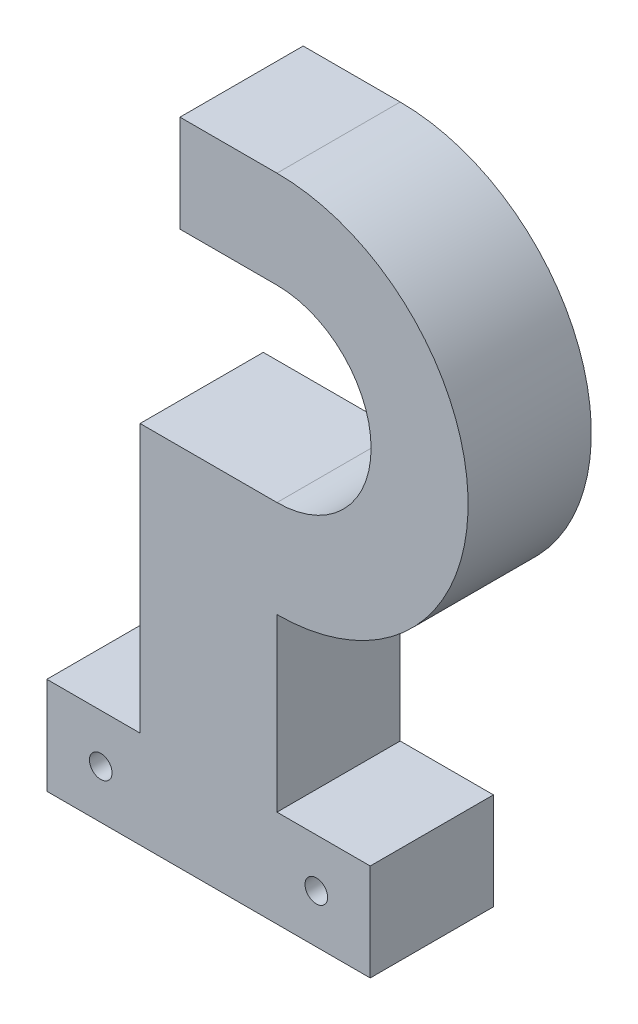
from build123d import *

# Parameters (mm, degrees)
BOSS_EXTRUDE1_DEPTH = 22.86
SKETCH4_W           = 25.40000152
SKETCH4_H           = 22.86
BOSS_EXTRUDE2_DEPTH = 31.75
BOSS_EXTRUDE3_DEPTH = 22.86
SKETCH6_R           = 2.100001769
CUT_EXTRUDE1_DEPTH  = 22.86


with BuildPart() as part:
    # Sketch3 → Boss-Extrude1 (new body)
    with BuildSketch(Plane.XY.offset(-6.35)):
        with BuildLine():
            Line((-28.0637741, -48), (-2.66377258, -48))
            ThreePointArc((-2.66377258, -48), (32.79872742, -12.5375), (-2.66377258, 22.925))
            Line((-2.66377258, 22.925), (-20.6637745, 22.925))
            Line((-20.6637745, 22.925), (-20.6637745, 4.925))
            Line((-20.6637745, 4.925), (-2.66377258, 4.925))
            ThreePointArc((-2.66377258, 4.925), (14.79872742, -12.5375), (-2.66377258, -30))
            Line((-2.66377258, -30), (-28.0637741, -30))
            Line((-28.0637741, -30), (-28.0637741, -48))
        make_face()
    extrude(amount=-BOSS_EXTRUDE1_DEPTH)

    # Sketch4 → Boss-Extrude2 (add)
    with BuildSketch(Plane.XZ.offset(48)):
        with Locations((-15.36377334, -17.78)):
            Rectangle(SKETCH4_W, SKETCH4_H)
    extrude(amount=BOSS_EXTRUDE2_DEPTH)

    # Sketch5 → Boss-Extrude3 (add)
    with BuildSketch(Plane.XY.offset(-6.35)):
        Polygon((-15.36377334, -79.75), (14.636226604, -79.75), (14.636226604, -97.750000068), (-45.363773284, -97.750000068), (-45.363773284, -79.75), align=None)
    extrude(amount=-BOSS_EXTRUDE3_DEPTH)

    # Sketch6 → Cut-Extrude1 (cut)
    with BuildSketch(Plane.XY.offset(-6.35)):
        with Locations((-35.363773472, -88.750000034)):
            Circle(SKETCH6_R)
        with Locations((4.636226792, -88.750000034)):
            Circle(SKETCH6_R)
    extrude(amount=-CUT_EXTRUDE1_DEPTH, mode=Mode.SUBTRACT)


solid = part.part
